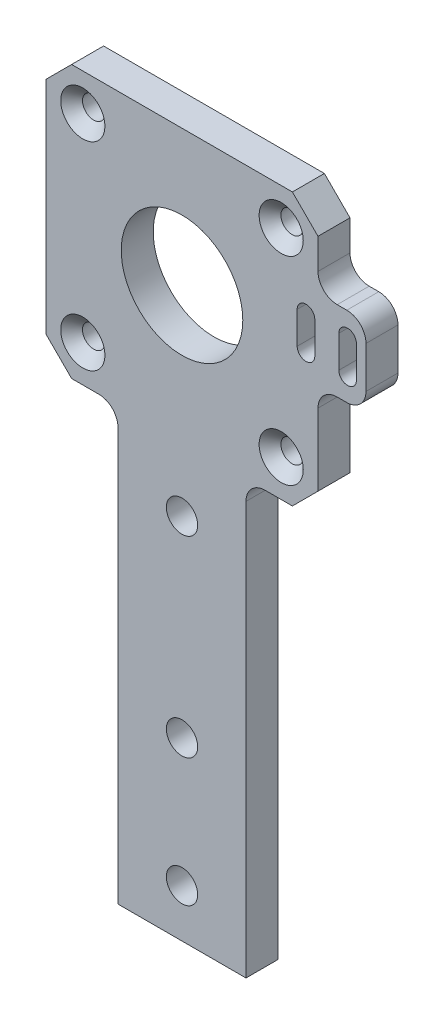
from build123d import *

# Parameters (mm, degrees)
SKETCH_1_R          = 1.75
SKETCH_1_R_2        = 9.5
SKETCH_1_R_3        = 2.45
EXTRUDE_1_DEPTH     = 5
CHAMFER_1_SIZE      = 4
FILLET_1_R          = 3
CHAMFER_2_SIZE      = 1.7
CUT_EXTRUDE_1_DEPTH = 2


with BuildPart() as part:
    # Эскиз1 → Бобышка-Вытянуть1 (new body)
    with BuildSketch(Plane.XY):
        Polygon((-21.25, 21.25), (-21.25, -21.25), (-10, -21.25), (-10, -88.75), (10, -88.75), (10, -21.25), (21.25, -21.25), (21.25, -3), (28.75, -3), (28.75, 9.5), (21.25, 9.5), (21.25, 21.25), align=None)
        with Locations((-15.5, -15.5)):
            Circle(SKETCH_1_R, mode=Mode.SUBTRACT)
        with Locations((-15.5, 15.5)):
            Circle(SKETCH_1_R, mode=Mode.SUBTRACT)
        Circle(SKETCH_1_R_2, mode=Mode.SUBTRACT)
        with Locations((15.5, -15.5)):
            Circle(SKETCH_1_R, mode=Mode.SUBTRACT)
        with Locations((15.5, 15.5)):
            Circle(SKETCH_1_R, mode=Mode.SUBTRACT)
        with BuildLine():
            ThreePointArc((20.75, 0.75), (19.375, -0.625), (18, 0.75))
            Line((18, 0.75), (18, 5.75))
            ThreePointArc((18, 5.75), (19.375, 7.125), (20.75, 5.75))
            Line((20.75, 5.75), (20.75, 0.75))
        make_face(mode=Mode.SUBTRACT)
        with Locations((0, -31.25)):
            Circle(SKETCH_1_R_3, mode=Mode.SUBTRACT)
        with Locations((0, -81.25)):
            Circle(SKETCH_1_R_3, mode=Mode.SUBTRACT)
        with Locations((0, -61.25)):
            Circle(SKETCH_1_R_3, mode=Mode.SUBTRACT)
        with BuildLine():
            Line((24.5, 0.75), (24.5, 5.75))
            ThreePointArc((24.5, 5.75), (25.875, 7.125), (27.25, 5.75))
            Line((27.25, 5.75), (27.25, 0.75))
            ThreePointArc((27.25, 0.75), (25.875, -0.625), (24.5, 0.75))
        make_face(mode=Mode.SUBTRACT)
    extrude(amount=EXTRUDE_1_DEPTH)

    # Фаска1
    chamfer_1_edges = [part.edges().sort_by_distance(p)[0] for p in [
        (-21.25, -21.25, 2.5),
        (-21.25, 21.25, 2.5),
        (21.25, 21.25, 2.5),
        (21.25, -21.25, 2.5),
    ]]
    chamfer(chamfer_1_edges, length=CHAMFER_1_SIZE)

    # Скругление1
    fillet_1_edges = [part.edges().sort_by_distance(p)[0] for p in [
        (21.25, 9.5, 2.5),
        (28.75, 9.5, 2.5),
        (28.75, -3, 2.5),
        (21.25, -3, 2.5),
        (10, -21.25, 2.5),
        (-10, -21.25, 2.5),
    ]]
    fillet(fillet_1_edges, radius=FILLET_1_R)

    # Фаска2
    chamfer_2_edges = [part.edges().sort_by_distance(p)[0] for p in [
        (-17.25, -15.5, 5),
        (13.75, -15.5, 5),
        (13.75, 15.5, 5),
        (-17.25, 15.5, 5),
    ]]
    chamfer(chamfer_2_edges, length=CHAMFER_2_SIZE)

    # Эскиз2 → Вырез-Вытянуть1 (cut)
    with BuildSketch(Plane(origin=(0, 0, 0), x_dir=(-1, 0, 0), z_dir=(0, 0, -1))):
        with BuildLine():
            Line((-28.25, 5.75), (-28.25, 0.75))
            ThreePointArc((-28.25, 0.75), (-25.875, -1.625), (-23.5, 0.75))
            Line((-23.5, 0.75), (-23.5, 5.75))
            ThreePointArc((-23.5, 5.75), (-25.875, 8.125), (-28.25, 5.75))
        make_face()
        with BuildLine():
            Line((-17, 0.75), (-17, 5.75))
            ThreePointArc((-17, 5.75), (-19.375, 8.125), (-21.75, 5.75))
            Line((-21.75, 5.75), (-21.75, 0.75))
            ThreePointArc((-21.75, 0.75), (-19.375, -1.625), (-17, 0.75))
        make_face()
    extrude(amount=-CUT_EXTRUDE_1_DEPTH, mode=Mode.SUBTRACT)


solid = part.part
